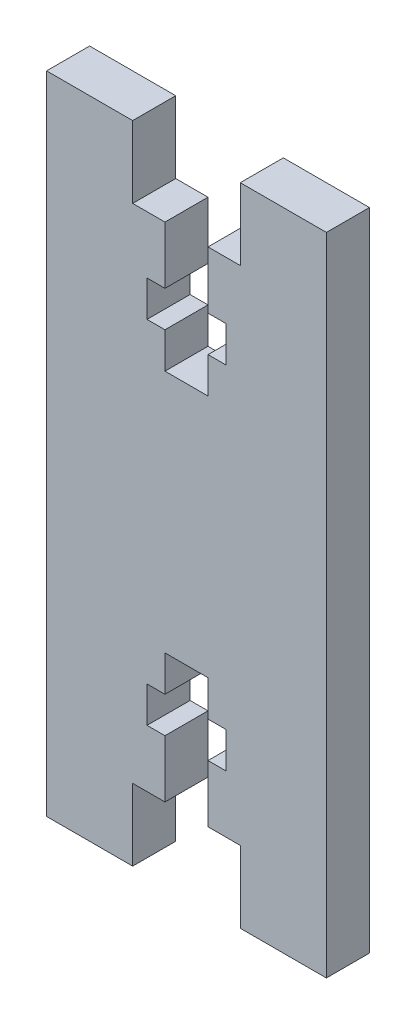
from build123d import *

# Parameters (mm, degrees)
RESSALTO_EXTRUS_O1_DEPTH = 3


with BuildPart() as part:
    # Esboço1 → Ressalto-extrusão1 (new body)
    with BuildSketch(Plane.XY):
        Polygon((0, 0), (2.25, 0), (2.25, -4), (1, -4), (1, -6.5), (2.25, -6.5), (2.25, -9), (5.25, -9), (5.25, -6.5), (6.5, -6.5), (6.5, -4), (5.25, -4), (5.25, 0), (7.5, 0), (7.5, 5), (13.5, 5), (13.5, 0), (13.5, -35), (13.5, -40), (7.5, -40), (7.5, -35), (5.25, -35), (5.25, -31), (6.5, -31), (6.5, -28.5), (5.25, -28.5), (5.25, -26), (2.25, -26), (2.25, -28.5), (1, -28.5), (1, -31), (2.25, -31), (2.25, -35), (0, -35), (0, -40), (-6, -40), (-6, -35), (-6, 0), (-6, 5), (0, 5), align=None)
    extrude(amount=RESSALTO_EXTRUS_O1_DEPTH)


solid = part.part
